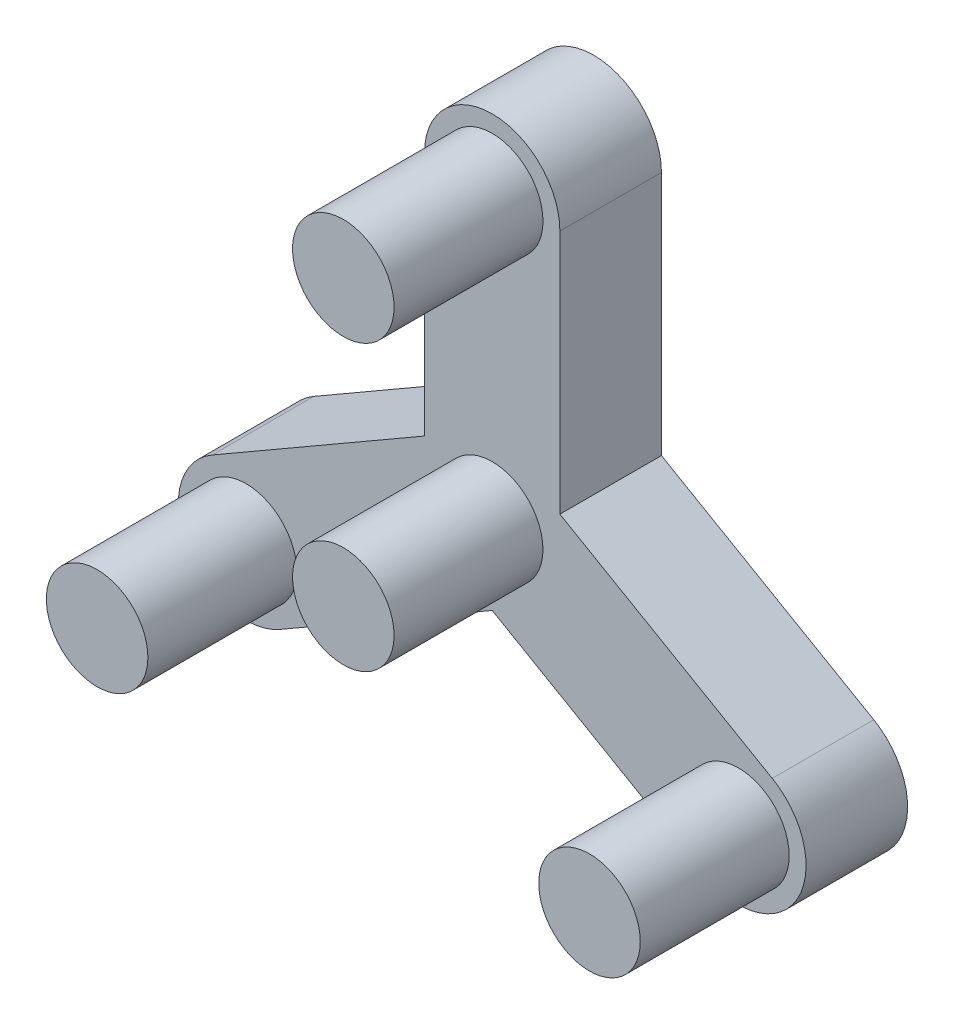
from build123d import *

# Parameters (mm, degrees)
CARRIER_BASE_DEPTH  = 7.5
SKETCH3_R           = 7.5
PLANET_SHAFTS_DEPTH = 22
SKETCH4_R           = 7.5
SUN_SHAFT_DEPTH     = 22


with BuildPart() as part:
    # Sketch1 → Carrier Base (new, symmetric)
    with BuildSketch(Plane.XY):
        with BuildLine():
            Line((0, -11.547005384), (-31.373066961, -29.660254039))
            ThreePointArc((-31.373066961, -29.660254039), (-45.033320997, -26), (-41.373066961, -12.339745963))
            Line((-41.373066961, -12.339745963), (-10, 5.773502692))
            Line((-10, 5.773502692), (-10, 42.000000002))
            ThreePointArc((-10, 42.000000002), (0, 52), (10, 42.000000002))
            Line((10, 42.000000002), (10, 5.773502692))
            Line((10, 5.773502692), (41.373066961, -12.339745963))
            ThreePointArc((41.373066961, -12.339745963), (45.033320997, -26), (31.373066961, -29.660254039))
            Line((31.373066961, -29.660254039), (0, -11.547005384))
        make_face()
    extrude(amount=CARRIER_BASE_DEPTH, both=True)

    # Sketch3 → Planet Shafts (add)
    with BuildSketch(Plane.XY.offset(7.5)):
        with Locations((0, 42)):
            Circle(SKETCH3_R)
        with Locations((36.373066959, -21)):
            Circle(SKETCH3_R)
        with Locations((-36.373066959, -21)):
            Circle(SKETCH3_R)
    extrude(amount=PLANET_SHAFTS_DEPTH)

    # Sketch4 → Sun Shaft (add)
    with BuildSketch(Plane.XY.offset(7.5)):
        Circle(SKETCH4_R)
    extrude(amount=SUN_SHAFT_DEPTH)


solid = part.part
